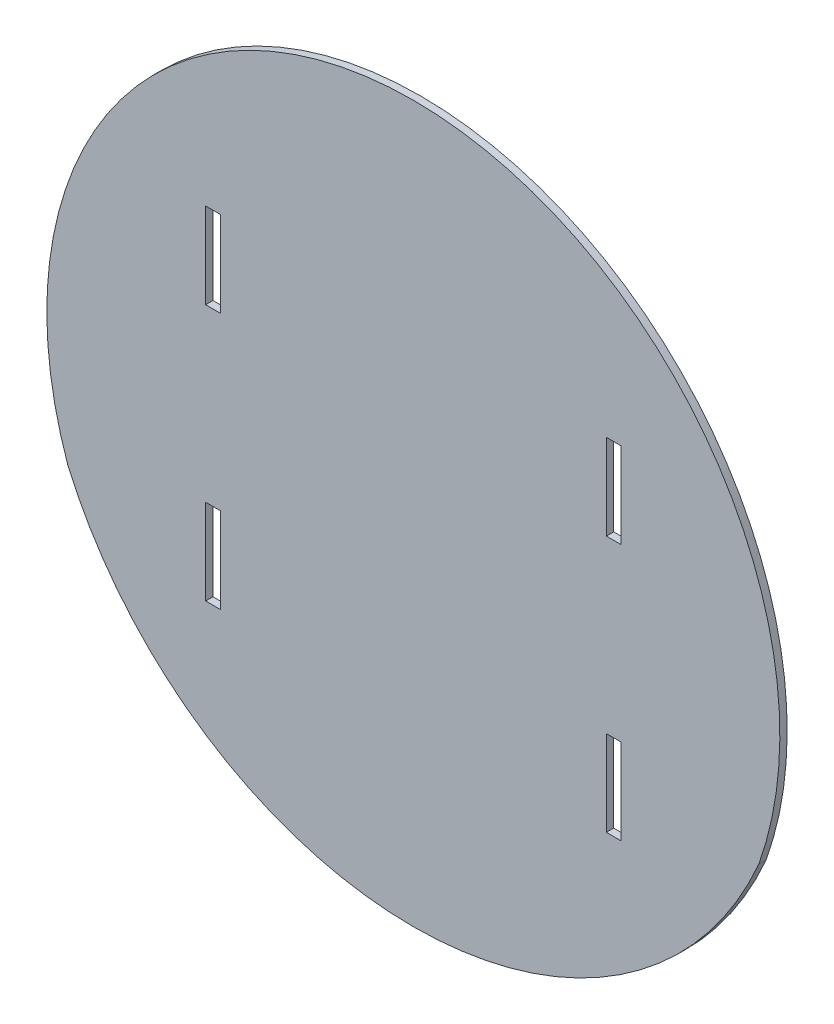
from build123d import *

# Parameters (mm, degrees)
ESBO_O1_W                = 6
ESBO_O1_H                = 35
RESSALTO_EXTRUS_O1_DEPTH = 3


with BuildPart() as part:
    # Esboço1 → Ressalto-extrusão1 (new body)
    with BuildSketch(Plane.XY):
        with BuildLine():
            ThreePointArc((141.421356237, -50), (0, 150), (-141.421356237, -50))
            ThreePointArc((-141.421356237, -50), (0, -142.957457878), (141.421356237, -50))
        make_face()
        with Locations((-82, -52.5)):
            Rectangle(ESBO_O1_W, ESBO_O1_H, mode=Mode.SUBTRACT)
        with Locations((-82, 52.5)):
            Rectangle(ESBO_O1_W, ESBO_O1_H, mode=Mode.SUBTRACT)
        with Locations((82, -52.5)):
            Rectangle(ESBO_O1_W, ESBO_O1_H, mode=Mode.SUBTRACT)
        with Locations((82, 52.5)):
            Rectangle(ESBO_O1_W, ESBO_O1_H, mode=Mode.SUBTRACT)
    extrude(amount=RESSALTO_EXTRUS_O1_DEPTH)


solid = part.part
